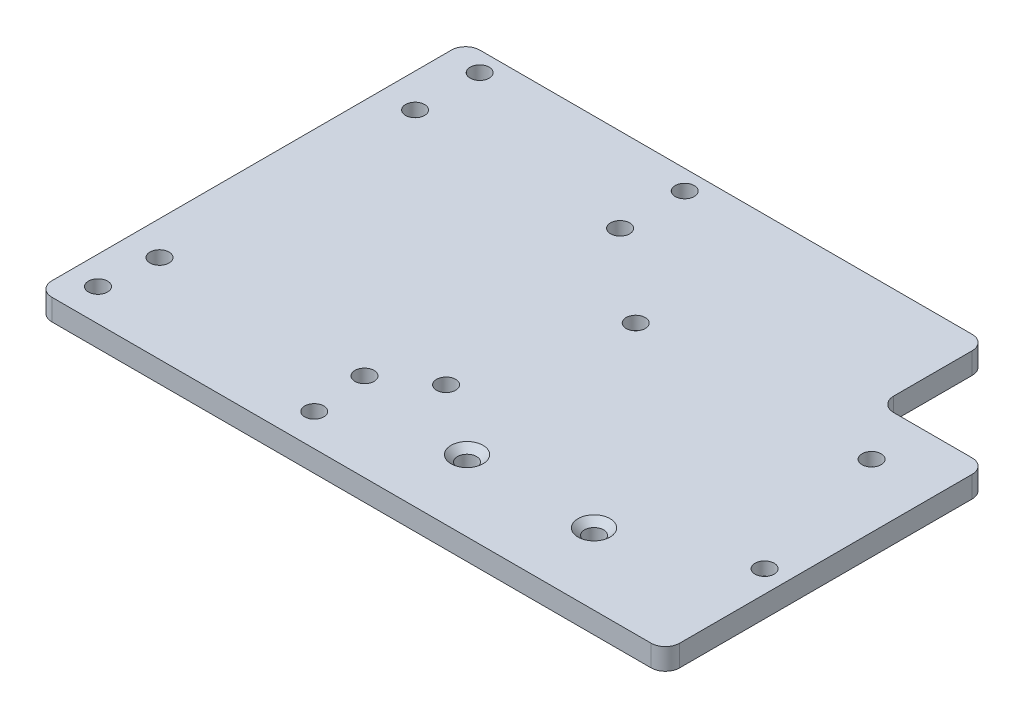
from build123d import *
from build123d.topology import SkipClean

# Parameters (mm, degrees)
SKETCH1_W                                       = 111.76
SKETCH1_H                                       = 76.2
BOSS_EXTRUDE1_DEPTH                             = 1.905
FILLET1_R                                       = 2.54
M3_CLEARANCE_HOLE4_D                            = 3.4
CSK_FOR_M3_FLAT_HEAD_MACHINE_SCREW1_D           = 3.4
CSK_FOR_M3_FLAT_HEAD_MACHINE_SCREW1_CSINK_D     = 6.3
CSK_FOR_M3_FLAT_HEAD_MACHINE_SCREW1_CSINK_ANGLE = 90
CSK_FOR_M3_FLAT_HEAD_MACHINE_SCREW2_D           = 3.4
CSK_FOR_M3_FLAT_HEAD_MACHINE_SCREW2_CSINK_D     = 6.3
CSK_FOR_M3_FLAT_HEAD_MACHINE_SCREW2_CSINK_ANGLE = 90
BOSS_EXTRUDE2_START                             = -3.81
SKETCH23_R                                      = 3.15
SKETCH23_R_2                                    = 1.7
BOSS_EXTRUDE2_DEPTH                             = 3.81
SKETCH12_W                                      = 28.355545758
SKETCH12_H                                      = 25.387795591
CUT_EXTRUDE1_DEPTH                              = 68.739947594
M3_CLEARANCE_HOLE1_AT_2_COUNT                   = 2
M3_CLEARANCE_HOLE1_AT_2_PITCH                   = 22.606
FILLET2_R                                       = 2.54


with BuildPart() as part:
    # Sketch1 → Boss-Extrude1 (new, symmetric)
    with BuildSketch(Plane(origin=(0, 0, 0), x_dir=(1, 0, 0), z_dir=(0, 1, 0))):
        Rectangle(SKETCH1_W, SKETCH1_H)
    extrude(amount=BOSS_EXTRUDE1_DEPTH, both=True)

    # Fillet1
    fillet1_edges = [part.edges().sort_by_distance(p)[0] for p in [
        (55.88, 0, 38.1),
        (-55.88, 0, 38.1),
        (-55.88, 0, -38.1),
        (55.88, 0, -38.1),
    ]]
    fillet(fillet1_edges, radius=FILLET1_R)

    # M3 Clearance Hole4 (through all)
    with Locations(Plane(origin=(0, -1.905, 0), x_dir=(-1, 0, 0), z_dir=(0, -1, 0))):
        with Locations((13.38, 34.6), (49.88, 34.6), (50.88, -32.35), (12.38, -32.35)):
            Hole(M3_CLEARANCE_HOLE4_D / 2)

    # CSK for M3 Flat Head Machine Screw1 (through all)
    with Locations(Plane(origin=(0, -1.905, 0), x_dir=(-1, 0, 0), z_dir=(0, -1, 0))):
        with Locations((-51.9557, -16.51), (4.74472, -16.51), (-44.6057, 9.89), (-2.60528, 9.89)):
            CounterSinkHole(CSK_FOR_M3_FLAT_HEAD_MACHINE_SCREW1_D / 2, CSK_FOR_M3_FLAT_HEAD_MACHINE_SCREW1_CSINK_D / 2, counter_sink_angle=CSK_FOR_M3_FLAT_HEAD_MACHINE_SCREW1_CSINK_ANGLE)

    # CSK for M3 Flat Head Machine Screw2 (through all)
    with Locations(Plane(origin=(0, -1.905, 0), x_dir=(-1, 0, 0), z_dir=(0, -1, 0))):
        with Locations((49.88, 23.1), (49.88, -22.4), (13.38, 23.1), (13.38, -22.4)):
            CounterSinkHole(CSK_FOR_M3_FLAT_HEAD_MACHINE_SCREW2_D / 2, CSK_FOR_M3_FLAT_HEAD_MACHINE_SCREW2_CSINK_D / 2, counter_sink_angle=CSK_FOR_M3_FLAT_HEAD_MACHINE_SCREW2_CSINK_ANGLE)

    # Sketch23 → Boss-Extrude2 (add)
    # profile 1 of 2: a face of its own
    with SkipClean():  # the faces are left unmerged after this step: merging them gives an invalid solid
        with BuildSketch(Plane.XZ.offset(1.905).offset(BOSS_EXTRUDE2_START)):
            with Locations((-13.38, 22.4)):
                Circle(SKETCH23_R)
            with Locations(Location((-13.38, 22.4, 0), (0, 0, 270))):
                Circle(SKETCH23_R_2, mode=Mode.SUBTRACT)
        # profile 2 of 2: a face of its own
        with BuildSketch(Plane.XZ.offset(1.905).offset(BOSS_EXTRUDE2_START)):
            with Locations((-49.88, 22.4)):
                Circle(SKETCH23_R)
            with Locations(Location((-49.88, 22.4, 0), (0, 0, 270))):
                Circle(SKETCH23_R_2, mode=Mode.SUBTRACT)
        extrude(amount=BOSS_EXTRUDE2_DEPTH)

    # Sketch12 → Cut-Extrude1 (cut, through all)
    with SkipClean():  # the faces are left unmerged after this step: merging them gives an invalid solid
        with BuildSketch(Plane.XZ.offset(1.905)):
            with Locations((51.007772879, -31.743897796)):
                Rectangle(SKETCH12_W, SKETCH12_H)
        extrude(amount=-CUT_EXTRUDE1_DEPTH, mode=Mode.SUBTRACT)

    # Sketch16 → M3 Clearance Hole1 (revolve, cut)
    with SkipClean():  # the faces are left unmerged after this step: merging them gives an invalid solid
        with BuildSketch(Plane(origin=(30.48, -1.905, 25.4), x_dir=(0, 0, -1), z_dir=(1, 0, 0))):
            Polygon((0, 0), (0, 3.81), (2.85, 3.81), (1.7, 2.66), (1.7, 0), align=None)
        m3_clearance_hole1 = revolve(axis=Axis((30.48, -8.255, 25.4), (0, 1, 0)), mode=Mode.SUBTRACT)

    # M3 Clearance Hole1 at 2: M3 Clearance Hole1 ×2
    with SkipClean():  # the faces are left unmerged after this step: merging them gives an invalid solid
        with Locations(*[(-i * M3_CLEARANCE_HOLE1_AT_2_PITCH, 0, 0) for i in range(1, M3_CLEARANCE_HOLE1_AT_2_COUNT)]):
            add(m3_clearance_hole1, mode=Mode.SUBTRACT)

    # Fillet2
    fillet2_edges = [part.edges().sort_by_distance(p)[0] for p in [
        (36.83, 0, -38.1),
        (55.88, 0, -19.05),
        (36.83, 0, -19.05),
    ]]
    fillet(fillet2_edges, radius=FILLET2_R)


solid = part.part
